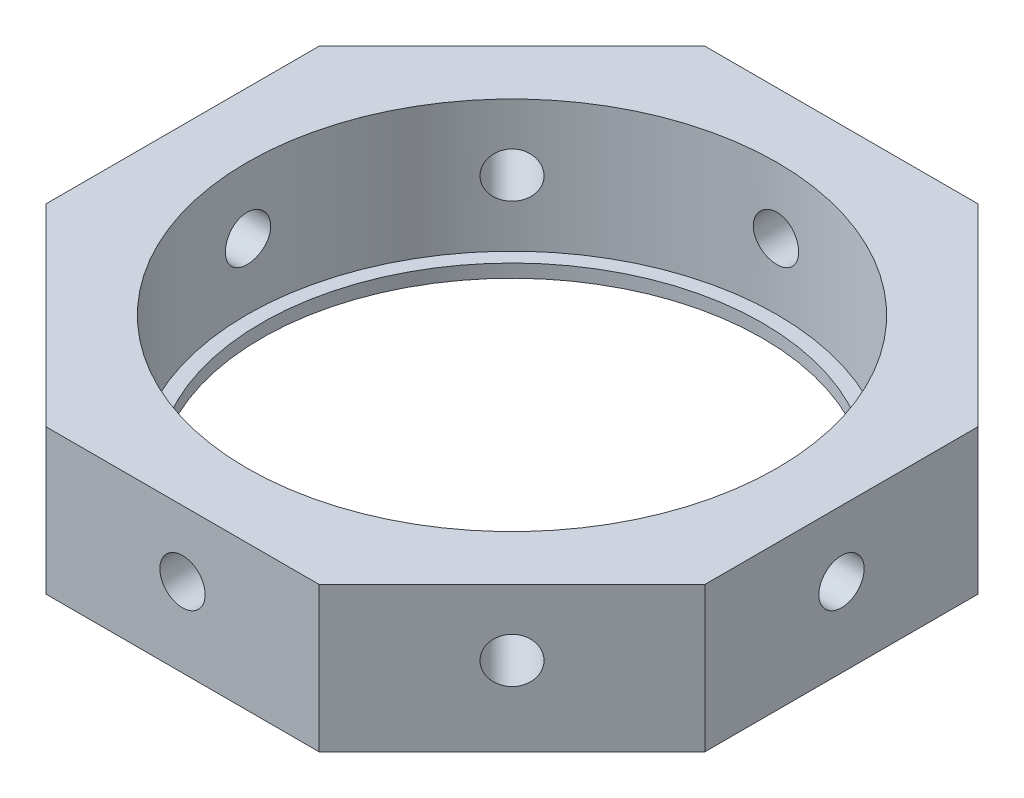
from build123d import *

# Parameters (mm, degrees)
SKETCH1_R           = 51.054
BOSS_EXTRUDE1_DEPTH = 25.4
SKETCH2_R           = 4.365625
CUT_EXTRUDE1_DEPTH  = 31.75
CIRPATTERN1_COUNT   = 8
SKETCH3_R           = 48.26
BOSS_EXTRUDE2_DEPTH = 2.54


with BuildPart() as part:
    # Sketch1 → Boss-Extrude1 (new body)
    with BuildSketch(Plane(origin=(0, 0, 0), x_dir=(1, 0, 0), z_dir=(0, 1, 0))):
        Polygon((63.5, 26.302561211), (26.302561211, 63.5), (-26.302561211, 63.5), (-63.5, 26.302561211), (-63.5, -26.302561211), (-26.302561211, -63.5), (26.302561211, -63.5), (63.5, -26.302561211), align=None)
        with Locations(Location((0, 0, 0), (0, 0, 270))):
            Circle(SKETCH1_R, mode=Mode.SUBTRACT)
    extrude(amount=BOSS_EXTRUDE1_DEPTH)

    # Sketch2 → Cut-Extrude1 (cut)
    with BuildSketch(Plane(origin=(63.5, 0, 0), x_dir=(0, 0, -1), z_dir=(1, 0, 0))):
        with Locations((0, 12.7)):
            Circle(SKETCH2_R)
    cut_extrude1 = extrude(amount=-CUT_EXTRUDE1_DEPTH, mode=Mode.SUBTRACT)

    # CirPattern1: Cut-Extrude1 ×8 about axis
    cirpattern1_axis = Axis((0, 25.4, 0), (0, -1, 0))
    for i in range(1, CIRPATTERN1_COUNT):
        add(cut_extrude1.rotate(cirpattern1_axis, i * 360 / CIRPATTERN1_COUNT), mode=Mode.SUBTRACT)

    # Sketch3 → Boss-Extrude2 (add)
    with BuildSketch(Plane.XZ):
        Polygon((26.302561211, 63.5), (-26.302561211, 63.5), (-63.5, 26.302561211), (-63.5, -26.302561211), (-26.302561211, -63.5), (26.302561211, -63.5), (63.5, -26.302561211), (63.5, 26.302561211), align=None)
        with Locations(Location((0, 0, 0), (0, 0, 270))):
            Circle(SKETCH3_R, mode=Mode.SUBTRACT)
    extrude(amount=BOSS_EXTRUDE2_DEPTH)


solid = part.part
